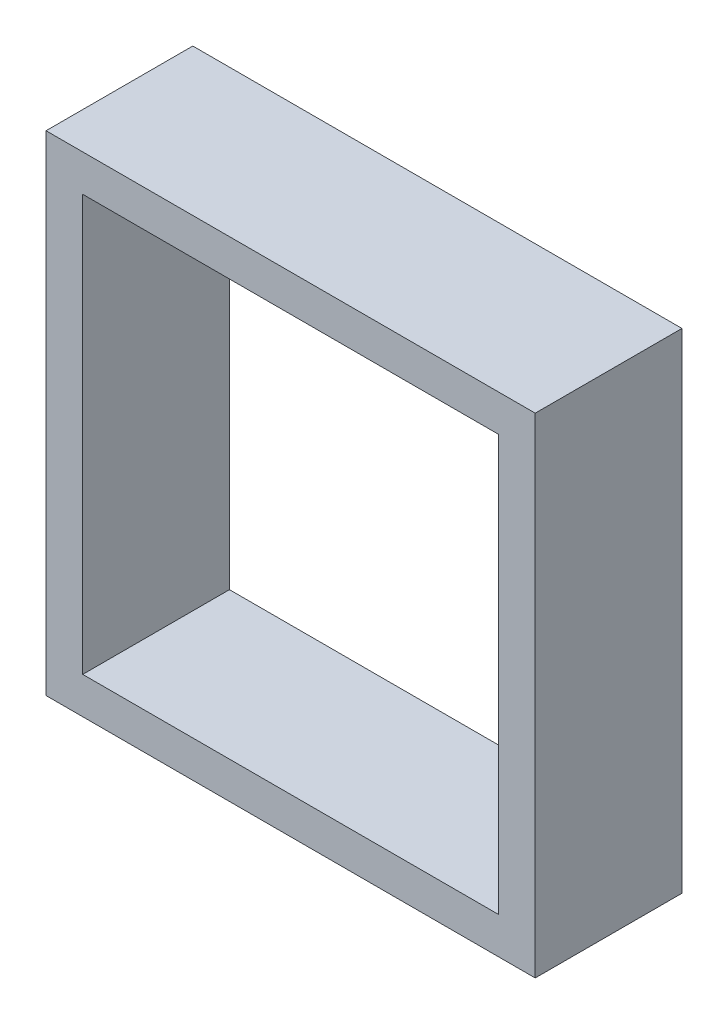
from build123d import *

# Parameters (mm, degrees)
SKETCH1_W           = 508
SKETCH1_H           = 508
SKETCH1_W_2         = 431.8
SKETCH1_H_2         = 431.8
BOSS_EXTRUDE1_DEPTH = 152.4


with BuildPart() as part:
    # Sketch1 → Boss-Extrude1 (new body)
    with BuildSketch(Plane.XY):
        with Locations((254, 254)):
            Rectangle(SKETCH1_W, SKETCH1_H)
        with Locations((254, 254)):
            Rectangle(SKETCH1_W_2, SKETCH1_H_2, mode=Mode.SUBTRACT)
    extrude(amount=BOSS_EXTRUDE1_DEPTH)


solid = part.part
